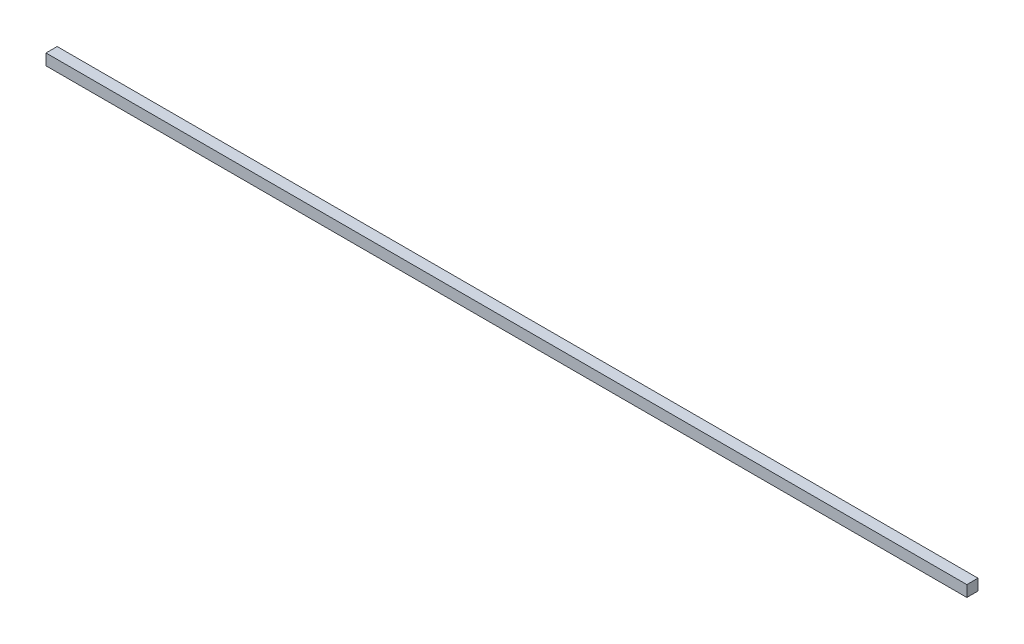
from build123d import *

# Parameters (mm, degrees)
TOPPING_KLAPE_ALT1_PIVOT_MIL_1_START = 22
SKETCH1_W                            = 660
SKETCH1_H                            = 8
TOPPING_KLAPE_ALT1_PIVOT_MIL_1_DEPTH = 8


with BuildPart() as part:
    # Sketch1 → TOPPING_klape_alt1_pivot_mil_1 (new body)
    with BuildSketch(Plane.XY.offset(TOPPING_KLAPE_ALT1_PIVOT_MIL_1_START)):
        with Locations((350, 466)):
            Rectangle(SKETCH1_W, SKETCH1_H)
    extrude(amount=TOPPING_KLAPE_ALT1_PIVOT_MIL_1_DEPTH)


solid = part.part
